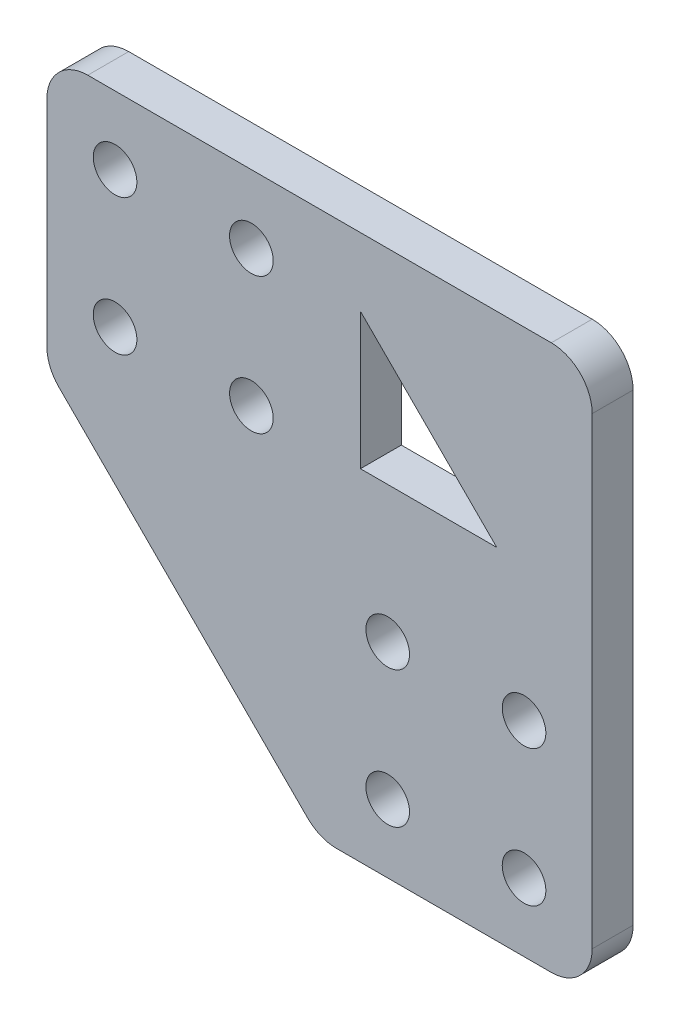
from build123d import *

# Parameters (mm, degrees)
SKETCH_1_R      = 1.6
EXTRUDE_1_DEPTH = 3
FILLET_1_R      = 3


with BuildPart() as part:
    # 草图1 → 凸台-拉伸1 (new body)
    with BuildSketch(Plane.XY):
        Polygon((0, 0), (40, 0), (40, -40), (20, -40), (0, -20), align=None)
        with Locations((5, -5)):
            Circle(SKETCH_1_R, mode=Mode.SUBTRACT)
        with Locations(Location((15, -5, 0), (0, 0, 180))):
            Circle(SKETCH_1_R, mode=Mode.SUBTRACT)
        with Locations((15, -15)):
            Circle(SKETCH_1_R, mode=Mode.SUBTRACT)
        with Locations(Location((5, -15, 0), (0, 0, 180))):
            Circle(SKETCH_1_R, mode=Mode.SUBTRACT)
        with Locations((25, -35)):
            Circle(SKETCH_1_R, mode=Mode.SUBTRACT)
        with Locations(Location((35, -35, 0), (0, 0, 180))):
            Circle(SKETCH_1_R, mode=Mode.SUBTRACT)
        with Locations((35, -25)):
            Circle(SKETCH_1_R, mode=Mode.SUBTRACT)
        with Locations(Location((25, -25, 0), (0, 0, 180))):
            Circle(SKETCH_1_R, mode=Mode.SUBTRACT)
        Polygon((23, -5), (23, -15), (33, -15), align=None, mode=Mode.SUBTRACT)
    extrude(amount=EXTRUDE_1_DEPTH)

    # 圆角1
    fillet_1_edges = [part.edges().sort_by_distance(p)[0] for p in [
        (0, 0, 1.5),
        (40, 0, 1.5),
        (40, -40, 1.5),
        (20, -40, 1.5),
        (0, -20, 1.5),
    ]]
    fillet(fillet_1_edges, radius=FILLET_1_R)


solid = part.part
